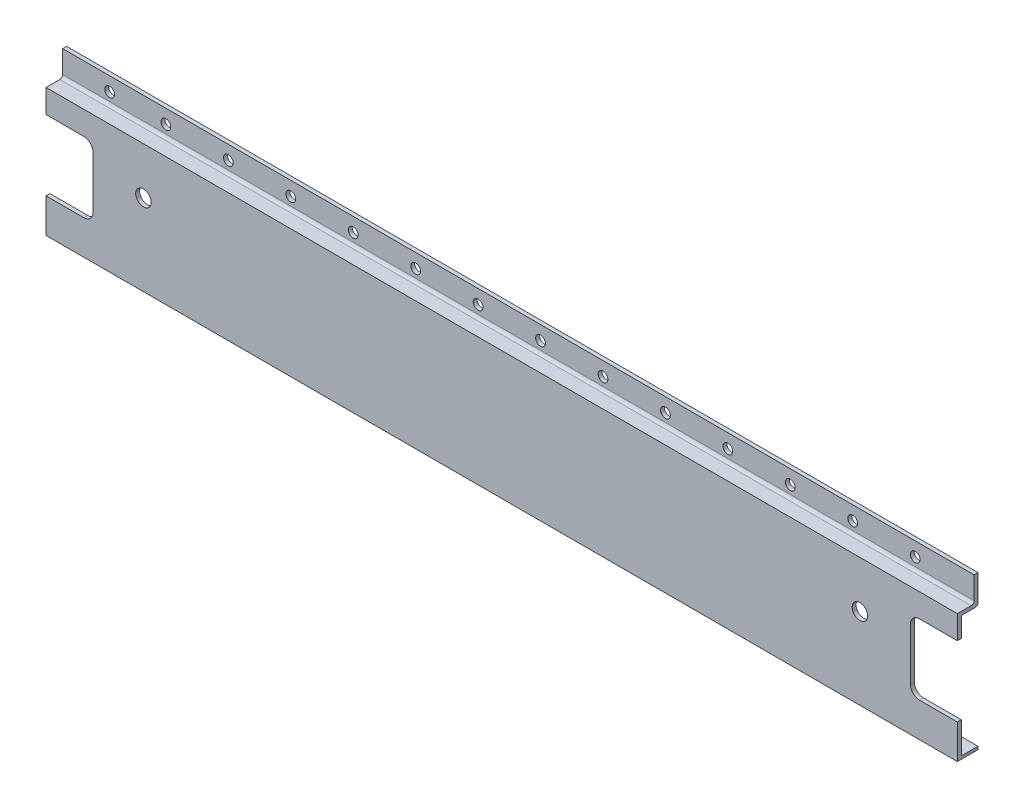
from build123d import *

# Parameters (mm, degrees)
SKETCH1_W                = 641.35
SKETCH1_H                = 107.95
BOSS_EXTRUDE1_DEPTH      = 14.5161
SKETCH2_W                = 641.35
SKETCH2_H                = 17.78
CUT_EXTRUDE1_DEPTH       = 11.7602
SKETCH3_W                = 641.35
SKETCH3_H                = 85.5345
CUT_EXTRUDE3_DEPTH       = 11.7602
FILLET1_R                = 2.032
CUT_EXTRUDE4_DEPTH       = 326.398307546
SKETCH5_R                = 3.429
CUT_EXTRUDE5_DEPTH       = 11.7602
SKETCH6_R                = 5.461
CUT_EXTRUDE6_DEPTH       = 11.7602
SKETCH7_R                = 2.54
CUT_EXTRUDE7_DEPTH       = 2.54
BOSS_EXTRUDE2_DEPTH      = 16.764
BOSS_EXTRUDE2_DEPTH_BACK = 2.0955
SKETCH8_W                = 641.35
SKETCH8_H                = 17.018
SKETCH9_W                = 69.85
SKETCH9_H                = 17.018
CUT_EXTRUDE8_DEPTH       = 334.255435273
SHELL1_T                 = -2.032
SKETCH10_W               = 501.65
SKETCH10_H               = 15.24
CUT_EXTRUDE9_DEPTH       = 14.986
FILLET2_R                = 3.175
SKETCH11_R               = 3.175
CUT_EXTRUDE10_DEPTH      = 16.764


with BuildPart() as part:
    # Sketch1 → Boss-Extrude1 (new body)
    with BuildSketch(Plane.XY):
        Rectangle(SKETCH1_W, SKETCH1_H)
    extrude(amount=BOSS_EXTRUDE1_DEPTH)

    # Sketch2 → Cut-Extrude1 (cut)
    with BuildSketch(Plane.XY.offset(14.5161)):
        with Locations((0, 45.085)):
            Rectangle(SKETCH2_W, SKETCH2_H)
    extrude(amount=-CUT_EXTRUDE1_DEPTH, mode=Mode.SUBTRACT)

    # Sketch3 → Cut-Extrude3 (cut)
    with BuildSketch(Plane(origin=(0, 0, 0), x_dir=(-1, 0, 0), z_dir=(0, 0, -1))):
        with Locations((0, -9.11225)):
            Rectangle(SKETCH3_W, SKETCH3_H)
    extrude(amount=-CUT_EXTRUDE3_DEPTH, mode=Mode.SUBTRACT)

    # Fillet1
    fillet1_edges = [part.edges().sort_by_distance(p)[0] for p in [
        (0, 36.195, 2.7559),
        (0, 33.655, 0),
    ]]
    fillet(fillet1_edges, radius=FILLET1_R)

    # Sketch4 → Cut-Extrude4 (cut, through all)
    with BuildSketch(Plane(origin=(0, 0, 11.7602), x_dir=(-1, 0, 0), z_dir=(0, 0, -1))):
        with BuildLine():
            Line((-294.005, 19.685), (-320.675, 19.685))
            Line((-320.675, 19.685), (-320.675, -29.845))
            Line((-320.675, -29.845), (-294.005, -29.845))
            ThreePointArc((-294.005, -29.845), (-289.514871939, -27.985128061), (-287.655, -23.495))
            Line((-287.655, -23.495), (-287.655, 13.335))
            ThreePointArc((-287.655, 13.335), (-289.514871939, 17.825128061), (-294.005, 19.685))
        make_face()
        with BuildLine():
            Line((294.005, -29.845), (320.675, -29.845))
            Line((320.675, -29.845), (320.675, 19.685))
            Line((320.675, 19.685), (294.005, 19.685))
            ThreePointArc((294.005, 19.685), (289.514871939, 17.825128061), (287.655, 13.335))
            Line((287.655, 13.335), (287.655, -23.495))
            ThreePointArc((287.655, -23.495), (289.514871939, -27.985128061), (294.005, -29.845))
        make_face()
    extrude(amount=-CUT_EXTRUDE4_DEPTH, mode=Mode.SUBTRACT)

    # Sketch5 → Cut-Extrude5 (cut)
    with BuildSketch(Plane(origin=(0, 0, 0), x_dir=(-1, 0, 0), z_dir=(0, 0, -1))):
        with Locations((-279.222061941, 44.148206771)):
            Circle(SKETCH5_R)
        with Locations((-235.280061941, 44.148206771)):
            Circle(SKETCH5_R)
        with Locations((-191.338061941, 44.148206771)):
            Circle(SKETCH5_R)
        with Locations((-147.396061941, 44.148206771)):
            Circle(SKETCH5_R)
        with Locations((-103.454061941, 44.148206771)):
            Circle(SKETCH5_R)
        with Locations((-59.512061941, 44.148206771)):
            Circle(SKETCH5_R)
        with Locations((-15.570061941, 44.148206771)):
            Circle(SKETCH5_R)
        with Locations((28.371938059, 44.148206771)):
            Circle(SKETCH5_R)
        with Locations((72.313938059, 44.148206771)):
            Circle(SKETCH5_R)
        with Locations((116.255938059, 44.148206771)):
            Circle(SKETCH5_R)
        with Locations((160.197938059, 44.148206771)):
            Circle(SKETCH5_R)
        with Locations((204.139938059, 44.148206771)):
            Circle(SKETCH5_R)
        with Locations((248.081938059, 44.148206771)):
            Circle(SKETCH5_R)
        with Locations((287.655, 44.148206771)):
            Circle(SKETCH5_R)
    extrude(amount=-CUT_EXTRUDE5_DEPTH, mode=Mode.SUBTRACT)

    # Sketch6 → Cut-Extrude6 (cut)
    with BuildSketch(Plane(origin=(0, 0, 11.7602), x_dir=(-1, 0, 0), z_dir=(0, 0, -1))):
        with Locations((-252.095, 3.175)):
            Circle(SKETCH6_R)
        with Locations((252.095, 3.175)):
            Circle(SKETCH6_R)
    extrude(amount=-CUT_EXTRUDE6_DEPTH, mode=Mode.SUBTRACT)

    # Sketch7 → Cut-Extrude7 (cut)
    with BuildSketch(Plane(origin=(0, -51.8795, 0), x_dir=(1, 0, 0), z_dir=(0, 1, 0))):
        with Locations(Location((-206.375, -5.8801, 0), (0, 0, 180))):
            Circle(SKETCH7_R)
        with Locations(Location((-197.485, -5.8801, 0), (0, 0, 180))):
            Circle(SKETCH7_R)
        with Locations(Location((-188.595, -5.8801, 0), (0, 0, 180))):
            Circle(SKETCH7_R)
        with Locations(Location((197.485, -5.8801, 0), (0, 0, 270))):
            Circle(SKETCH7_R)
        with Locations(Location((188.595, -5.8801, 0), (0, 0, 270))):
            Circle(SKETCH7_R)
        with Locations(Location((206.375, -5.8801, 0), (0, 0, 270))):
            Circle(SKETCH7_R)
    extrude(amount=-CUT_EXTRUDE7_DEPTH, mode=Mode.SUBTRACT)


with BuildPart() as body_2:
    # Sketch8 → Boss-Extrude2 (new, two sides: drawn at the far end of the back side and taken through both)
    with BuildSketch(Plane(origin=(0, -51.8795, 0), x_dir=(1, 0, 0), z_dir=(0, 1, 0)).offset(-BOSS_EXTRUDE2_DEPTH_BACK)):
        with Locations((0, 8.509)):
            Rectangle(SKETCH8_W, SKETCH8_H)
    extrude(amount=BOSS_EXTRUDE2_DEPTH + BOSS_EXTRUDE2_DEPTH_BACK)

    # Sketch9 → Cut-Extrude8 (cut, through all)
    with BuildSketch(Plane(origin=(0, -35.1155, 0), x_dir=(1, 0, 0), z_dir=(0, 1, 0))):
        with Locations((285.75, 8.509)):
            Rectangle(SKETCH9_W, SKETCH9_H)
        with Locations((-285.75, 8.509)):
            Rectangle(SKETCH9_W, SKETCH9_H)
    extrude(amount=-CUT_EXTRUDE8_DEPTH, mode=Mode.SUBTRACT)

    # Shell1
    shell1_openings = [body_2.faces().sort_by_distance(p)[0] for p in [
        (0, -53.975, -8.509),
    ]]
    offset(amount=SHELL1_T, openings=shell1_openings, kind=Kind.INTERSECTION)

    # Sketch10 → Cut-Extrude9 (cut)
    with BuildSketch(Plane(origin=(0, 0, -17.018), x_dir=(-1, 0, 0), z_dir=(0, 0, -1))):
        with Locations((0, -46.355)):
            Rectangle(SKETCH10_W, SKETCH10_H)
    extrude(amount=-CUT_EXTRUDE9_DEPTH, mode=Mode.SUBTRACT)

    # Fillet2
    fillet2_edges = [body_2.edges().sort_by_distance(p)[0] for p in [
        (0, -35.1155, 0),
    ]]
    fillet(fillet2_edges, radius=FILLET2_R)

    # Sketch11 → Cut-Extrude10 (cut)
    with BuildSketch(Plane(origin=(0, -35.1155, 0), x_dir=(1, 0, 0), z_dir=(0, 1, 0))):
        with Locations(Location((-244.475, 10.0965, 0), (0, 0, 180))):
            Circle(SKETCH11_R)
        with Locations(Location((244.475, 10.0965, 0), (0, 0, 180))):
            Circle(SKETCH11_R)
    extrude(amount=-CUT_EXTRUDE10_DEPTH, mode=Mode.SUBTRACT)


solid = Compound([part.part, body_2.part])
